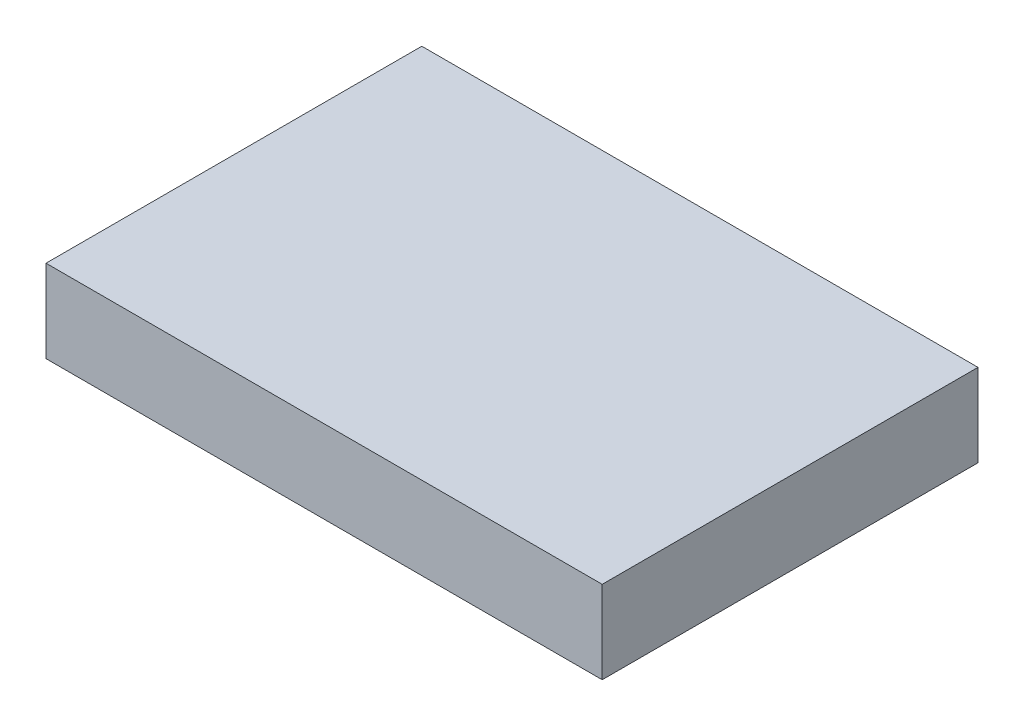
from build123d import *

# Parameters (mm, degrees)
SKETCH1_W           = 37
SKETCH1_H           = 25
BOSS_EXTRUDE1_DEPTH = 5.5


with BuildPart() as part:
    # Sketch1 → Boss-Extrude1 (new body)
    with BuildSketch(Plane(origin=(0, 0, 0), x_dir=(1, 0, 0), z_dir=(0, 1, 0))):
        Rectangle(SKETCH1_W, SKETCH1_H)
    extrude(amount=BOSS_EXTRUDE1_DEPTH)


solid = part.part
